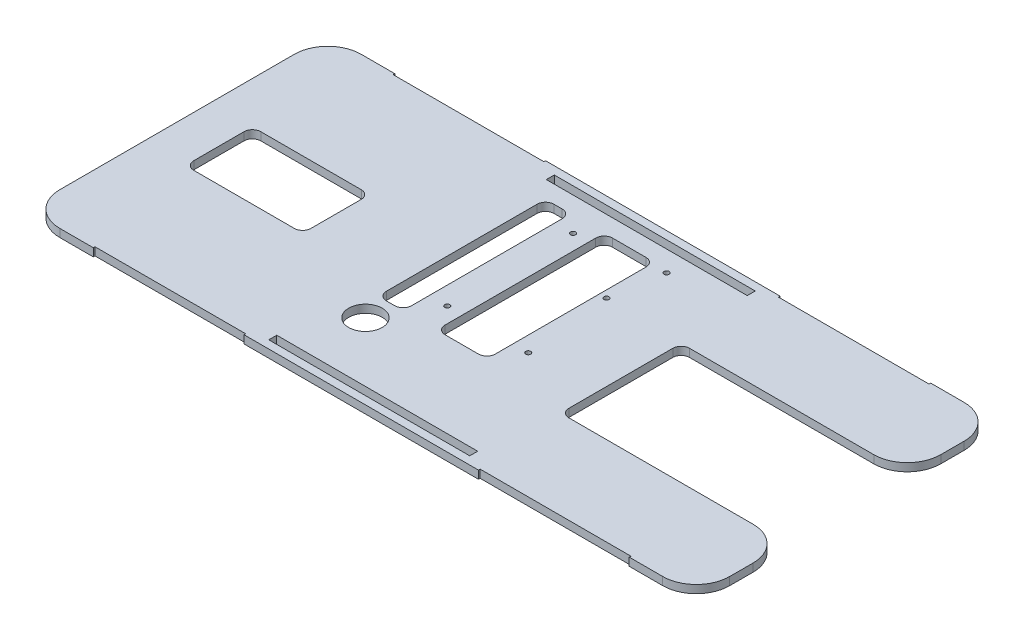
from build123d import *

# Parameters (mm, degrees)
BOSS_EXTRUDE1_DEPTH = 2.38125
SKETCH2_W           = 135
SKETCH2_H           = 72
CUT_EXTRUDE1_DEPTH  = 10
SKETCH3_R           = 10
SKETCH3_W           = 15
SKETCH3_H           = 100
SKETCH3_W_2         = 70
SKETCH3_H_2         = 40
SKETCH3_W_3         = 30
CUT_EXTRUDE2_DEPTH  = 10
SKETCH4_R           = 1.5
CUT_EXTRUDE3_DEPTH  = 10
SKETCH5_W           = 120
SKETCH5_H           = 4.7625
CUT_EXTRUDE4_DEPTH  = 10
FILLET1_R           = 20
FILLET2_R           = 20
FILLET3_R           = 5


with BuildPart() as part:
    # Sketch1 → Boss-Extrude1 (new, symmetric)
    with BuildSketch(Plane(origin=(0, 0, 0), x_dir=(1, 0, 0), z_dir=(0, 1, 0))):
        Polygon((-200, 90), (-160, 90), (-160, 89), (-70, 89), (-70, 90), (70, 90), (70, 89), (160, 89), (160, 90), (200, 90), (200, -90), (160, -90), (160, -89), (70, -89), (70, -90), (-70, -90), (-70, -89), (-160, -89), (-160, -90), (-200, -90), align=None)
    extrude(amount=BOSS_EXTRUDE1_DEPTH, both=True)

    # Sketch2 → Cut-Extrude1 (cut)
    with BuildSketch(Plane(origin=(0, 2.38125, 0), x_dir=(1, 0, 0), z_dir=(0, 1, 0))):
        with Locations((132.5, 0)):
            Rectangle(SKETCH2_W, SKETCH2_H)
    extrude(amount=-CUT_EXTRUDE1_DEPTH, mode=Mode.SUBTRACT)

    # Sketch3 → Cut-Extrude2 (cut)
    with BuildSketch(Plane(origin=(0, 2.38125, 0), x_dir=(1, 0, 0), z_dir=(0, 1, 0))):
        with Locations(Location((-42.5, -45, 0), (0, 0, 270))):
            Circle(SKETCH3_R)
        with Locations((-42.5, 20)):
            Rectangle(SKETCH3_W, SKETCH3_H)
        with Locations((-140, 0)):
            Rectangle(SKETCH3_W_2, SKETCH3_H_2)
        with Locations((0, 20)):
            Rectangle(SKETCH3_W_3, SKETCH3_H)
    extrude(amount=-CUT_EXTRUDE2_DEPTH, mode=Mode.SUBTRACT)

    # Sketch4 → Cut-Extrude3 (cut)
    with BuildSketch(Plane(origin=(0, 2.38125, 0), x_dir=(1, 0, 0), z_dir=(0, 1, 0))):
        with Locations(Location((24.1681, -14.4776, 0), (0, 0, 270))):
            Circle(SKETCH4_R)
        with Locations(Location((-24.1681, -14.4776, 0), (0, 0, 270))):
            Circle(SKETCH4_R)
        with Locations(Location((-24.1681, 60.6556, 0), (0, 0, 270))):
            Circle(SKETCH4_R)
        with Locations(Location((24.1681, 68.1486, 0), (0, 0, 270))):
            Circle(SKETCH4_R)
        with Locations(Location((19.289607234, 37.1479, 0), (0, 0, 270))):
            Circle(SKETCH4_R)
    extrude(amount=-CUT_EXTRUDE3_DEPTH, mode=Mode.SUBTRACT)

    # Sketch5 → Cut-Extrude4 (cut)
    with BuildSketch(Plane(origin=(0, 2.38125, 0), x_dir=(1, 0, 0), z_dir=(0, 1, 0))):
        with Locations((0, 82.85625)):
            Rectangle(SKETCH5_W, SKETCH5_H)
        with Locations((0, -82.85625)):
            Rectangle(SKETCH5_W, SKETCH5_H)
    extrude(amount=-CUT_EXTRUDE4_DEPTH, mode=Mode.SUBTRACT)

    # Fillet1
    fillet1_edges = [part.edges().sort_by_distance(p)[0] for p in [
        (-200, 0, -90),
        (200, 0, -90),
        (200, 0, 90),
        (-200, 0, 90),
    ]]
    fillet(fillet1_edges, radius=FILLET1_R)

    # Fillet2
    fillet2_edges = [part.edges().sort_by_distance(p)[0] for p in [
        (200, 0, -36),
        (200, 0, 36),
    ]]
    fillet(fillet2_edges, radius=FILLET2_R)

    # Fillet3
    fillet3_edges = [part.edges().sort_by_distance(p)[0] for p in [
        (-175, 0, 20),
        (-175, 0, -20),
        (-105, 0, -20),
        (-105, 0, 20),
        (-35, 0, -70),
        (-35, 0, 30),
        (-50, 0, 30),
        (-50, 0, -70),
        (65, 0, 36),
        (65, 0, -36),
        (-15, 0, 30),
        (-15, 0, -70),
        (15, 0, -70),
        (15, 0, 30),
    ]]
    fillet(fillet3_edges, radius=FILLET3_R)


solid = part.part
